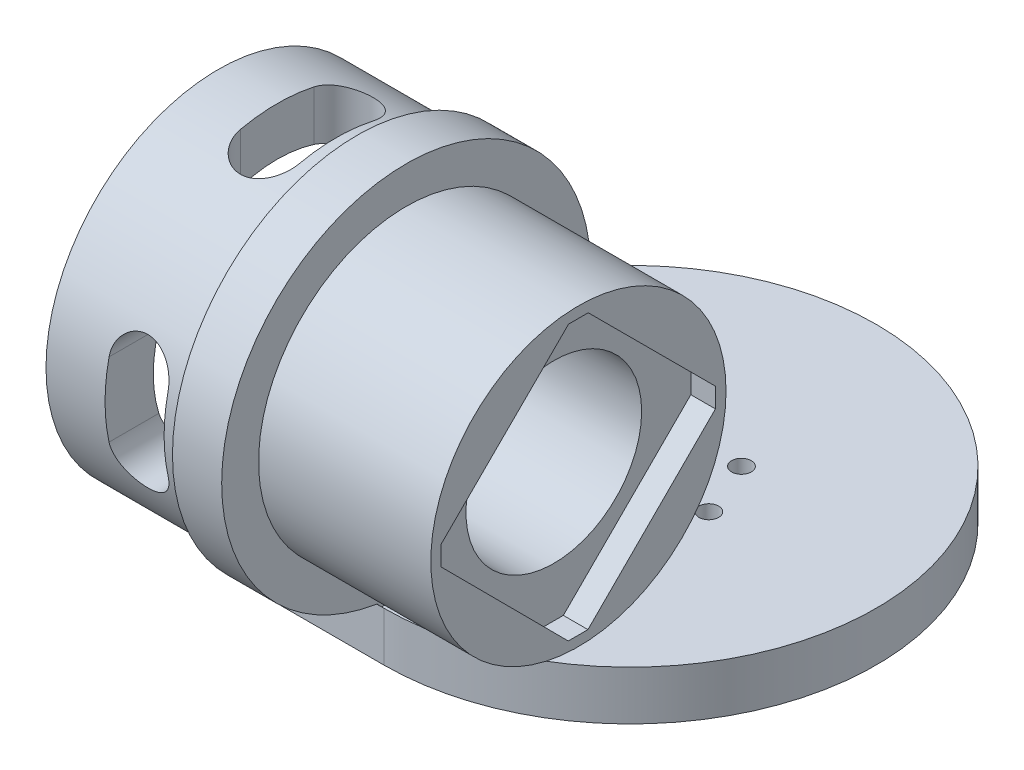
from build123d import *
from build123d.topology import SkipClean

# Parameters (mm, degrees)
SKETCH_1_R               = 50
EXTRUDE_1_DEPTH          = 10
SKETCH_2_R               = 1.9999999999999927
CUT_EXTRUDE_1_DEPTH      = 72.4142842854285
PATTERN_CIRCULAR_1_COUNT = 8
SKETCH_6_R               = 30
EXTRUDE_4_DEPTH          = 10
EXTRUDE_START            = -10
EXTRUDE_5_DEPTH          = 10
SKETCH_8_R               = 35
EXTRUDE_6_DEPTH          = 10
SKETCH_9_R               = 25.200000000000003
CUT_EXTRUDE_2_DEPTH      = 10
SKETCH_10_R              = 35
SKETCH_10_R_2            = 25.20000000000001
EXTRUDE_7_DEPTH          = 7.5
SKETCH_11_R              = 35
SKETCH_11_R_2            = 1.2500000000000047
SKETCH_11_R_3            = 1.2500000000000013
SKETCH_11_R_4            = 12.000000000000005
EXTRUDE_8_DEPTH          = 7
SKETCH_12_R              = 30
SKETCH_12_R_2            = 17.85
EXTRUDE_9_DEPTH          = 35
EXTRUDE_START_2          = 7
SKETCH_16_R              = 34.099999999999994
SKETCH_16_R_2            = 32.59999999999999
EXTRUDE_12_DEPTH         = 7
EXTRUDE_START_3          = 1.7
SKETCH_17_R              = 35
SKETCH_17_R_2            = 34.099999999999994
EXTRUDE_13_DEPTH         = 1.7
CUT_EXTRUDE_3_DEPTH      = 39.00000000000001
PATTERN_CIRCULAR_2_COUNT = 2
PATTERN_CIRCULAR_2_ANGLE = 90.0000000000002
EXTRUDE_14_DEPTH         = 5
EXTRUDE_14_DEPTH_BACK    = 5
SKETCH_19_R              = 37.50000000000001
SKETCH_19_R_2            = 30
EXTRUDE_15_REACH         = 139.9
SKETCH_22_R              = 30
EXTRUDE_16_DEPTH         = 5
EXTRUDE_17_DEPTH         = 5


with BuildPart() as part:
    # 草图1 → 凸台-拉伸1 (new body)
    with BuildSketch(Plane(origin=(0, 0, 0), x_dir=(1, 0, 0), z_dir=(0, 1, 0))):
        with Locations(Location((0, 0, 0), (0, 0, 270))):
            Circle(SKETCH_1_R)
    extrude(amount=EXTRUDE_1_DEPTH)

    # 草图2 → 切除-拉伸1 (cut, through all)
    with BuildSketch(Plane(origin=(0, 10, 0), x_dir=(1, 0, 0), z_dir=(0, 1, 0))):
        with Locations(Location((0, -15.999999999999996, 0), (0, 0, 270))):
            Circle(SKETCH_2_R)
    cut_extrude_1 = extrude(amount=-CUT_EXTRUDE_1_DEPTH, mode=Mode.SUBTRACT)

    # 阵列(圆周)1: 切除-拉伸1 ×8 about axis
    pattern_circular_1_axis = Axis((1.404e-14, 0, 3e-17), (0, 1, 0))
    for i in range(1, PATTERN_CIRCULAR_1_COUNT):
        add(cut_extrude_1.rotate(pattern_circular_1_axis, i * 360 / PATTERN_CIRCULAR_1_COUNT), mode=Mode.SUBTRACT)

    # 草图6 → 凸台-拉伸4 (add)
    with BuildSketch(Plane(origin=(-20, 0, 0), x_dir=(0, 0, -1), z_dir=(1, 0, 0))):
        with Locations((-45.00000000000001, 48)):
            Circle(SKETCH_6_R)
        with BuildLine():
            Line((-66.57470511060487, 27.1545664619217), (-50, 10))
            Line((-50, 10), (20, 10))
            Line((20, 10), (-20.793603948134574, 65.72146693082246))
            ThreePointArc((-20.793603948134578, 65.72146693082246), (-16.48516279587097, 57.322234668898794), (-15.000000000000007, 48))
            ThreePointArc((-15.000000000000007, 47.99999999999999), (-33.75813968504649, 20.185964394588957), (-66.57470511060488, 27.154566461921696))
        make_face()
    extrude(amount=-EXTRUDE_4_DEPTH)

    # 草图7 → 凸台-拉伸5 (add)
    with BuildSketch(Plane.XZ.offset(EXTRUDE_START)):
        with BuildLine():
            Line((-20, 50.000000000000014), (-30, 50.000000000000014))
            Line((-30, 50.000000000000014), (-44.11764705882355, 23.52941176470589))
            ThreePointArc((-44.11764705882352, 23.529411764705895), (-25.724787771376317, 42.874646285627215), (3.06e-15, 50))
            Line((0, 50), (-20, 50.000000000000014))
        make_face()
    extrude(amount=EXTRUDE_5_DEPTH)

    # 草图8 → 凸台-拉伸6 (add)
    with BuildSketch(Plane.ZY.offset(30)):
        with Locations((45.00000000000001, 48)):
            Circle(SKETCH_8_R)
    extrude(amount=-EXTRUDE_6_DEPTH)

    # 草图9 → 切除-拉伸2 (cut)
    with BuildSketch(Plane.ZY.offset(30)):
        with Locations((45.00000000000001, 48)):
            Circle(SKETCH_9_R)
    extrude(amount=-CUT_EXTRUDE_2_DEPTH, mode=Mode.SUBTRACT)

    # 草图10 → 凸台-拉伸7 (add)
    with SkipClean():  # the faces are left unmerged after this step: merging them gives an invalid solid
        with BuildSketch(Plane(origin=(-20, 0, 0), x_dir=(0, 0, -1), z_dir=(1, 0, 0))):
            with Locations(Location((-45.00000000000001, 48, 0), (0, 0, 255.017807985))):
                Circle(SKETCH_10_R)
            with Locations(Location((-45.00000000000001, 48, 0), (0, 0, 180))):
                Circle(SKETCH_10_R_2, mode=Mode.SUBTRACT)
        extrude(amount=EXTRUDE_7_DEPTH)

    # 草图11 → 凸台-拉伸8 (add)
    with SkipClean():  # the faces are left unmerged after this step: merging them gives an invalid solid
        with BuildSketch(Plane(origin=(-12.5, 0, 0), x_dir=(0, 0, -1), z_dir=(1, 0, 0))):
            with Locations(Location((-45.00000000000001, 48, 0), (0, 0, 255.017807985))):
                Circle(SKETCH_11_R)
            with Locations((-45.00000000000001, 63)):
                Circle(SKETCH_11_R_2, mode=Mode.SUBTRACT)
            with Locations((-30.000000000000007, 48)):
                Circle(SKETCH_11_R_3, mode=Mode.SUBTRACT)
            with Locations((-60.00000000000001, 48)):
                Circle(SKETCH_11_R_2, mode=Mode.SUBTRACT)
            with Locations((-45.00000000000001, 33)):
                Circle(SKETCH_11_R_2, mode=Mode.SUBTRACT)
            with Locations((-45.00000000000001, 48)):
                Circle(SKETCH_11_R_4, mode=Mode.SUBTRACT)
        extrude(amount=EXTRUDE_8_DEPTH)

    # 草图12 → 凸台-拉伸9 (add)
    with SkipClean():  # the faces are left unmerged after this step: merging them gives an invalid solid
        with BuildSketch(Plane(origin=(-5.500000000000001, 0, 0), x_dir=(0, 0, -1), z_dir=(1, 0, 0))):
            with Locations((-45.00000000000001, 48)):
                Circle(SKETCH_12_R)
            with Locations((-45.00000000000001, 48)):
                Circle(SKETCH_12_R_2, mode=Mode.SUBTRACT)
        extrude(amount=EXTRUDE_9_DEPTH)

    # 草图16 → 凸台-拉伸12 (add)
    # profile 1 of 2: a face of its own
    with SkipClean():  # the faces are left unmerged after this step: merging them gives an invalid solid
        with BuildSketch(Plane.ZY.offset(30).offset(EXTRUDE_START_2)):
            with BuildLine():
                ThreePointArc((54.04815853046854, 14.18978220703822), (72.7640554365388, 26.689035082455778), (80, 47.99999999999999))
                ThreePointArc((80, 48), (46.58925584695761, 82.96389946577628), (10.144327665547948, 51.17523323762416))
                ThreePointArc((10.144327665547948, 51.17523323762416), (22.4503250761864, 21.2322552158324), (54.04815853046854, 14.18978220703822))
            make_face()
            with Locations((45.00000000000001, 48)):
                Circle(SKETCH_16_R, mode=Mode.SUBTRACT)
        # profile 2 of 2: a face of its own
        with BuildSketch(Plane.ZY.offset(30).offset(EXTRUDE_START_2)):
            with Locations((45.00000000000001, 48)):
                Circle(SKETCH_16_R)
            with Locations((45.00000000000001, 48)):
                Circle(SKETCH_16_R_2, mode=Mode.SUBTRACT)
        extrude(amount=-EXTRUDE_12_DEPTH)

    # 草图17 → 凸台-拉伸13 (add)
    with SkipClean():  # the faces are left unmerged after this step: merging them gives an invalid solid
        with BuildSketch(Plane.ZY.offset(37).offset(EXTRUDE_START_3)):
            with Locations((45.00000000000001, 48)):
                Circle(SKETCH_17_R)
            with Locations((45.00000000000001, 48)):
                Circle(SKETCH_17_R_2, mode=Mode.SUBTRACT)
        extrude(amount=-EXTRUDE_13_DEPTH)

    # 草图18 → 切除-拉伸3 (cut)
    with SkipClean():  # the faces are left unmerged after this step: merging them gives an invalid solid
        with BuildSketch(Plane.XY.offset(50)):
            with BuildLine():
                Line((-14.700000000000037, 55.50000000000001), (-14.700000000000031, 40.5))
                ThreePointArc((-14.700000000000031, 40.5), (-20.70000000000003, 34.5), (-26.700000000000035, 40.5))
                Line((-26.700000000000035, 40.5), (-26.70000000000004, 55.49999999999999))
                ThreePointArc((-26.70000000000004, 55.49999999999999), (-20.70000000000004, 61.5), (-14.700000000000037, 55.50000000000001))
            make_face()
        cut_extrude_3 = extrude(amount=CUT_EXTRUDE_3_DEPTH, mode=Mode.SUBTRACT)

    # 阵列(圆周)2: 切除-拉伸3 ×2 about axis
    with SkipClean():  # the faces are left unmerged after this step: merging them gives an invalid solid
        pattern_circular_2_axis = Axis((78.99494936611666, 48, 45.00000000000001), (-1, 0, 0))
        for i in range(1, PATTERN_CIRCULAR_2_COUNT):
            add(cut_extrude_3.rotate(pattern_circular_2_axis, i * PATTERN_CIRCULAR_2_ANGLE / (PATTERN_CIRCULAR_2_COUNT - 1)), mode=Mode.SUBTRACT)

    # 草图19 → 凸台-拉伸14 (add, two sides: drawn at the far end of the back side and taken through both)
    with SkipClean():  # the faces are left unmerged after this step: merging them gives an invalid solid
        with BuildSketch(Plane(origin=(-5.500000000000001, 0, 0), x_dir=(0, 0, -1), z_dir=(1, 0, 0)).offset(-EXTRUDE_14_DEPTH_BACK)):
            with Locations((-45.00000000000001, 48)):
                Circle(SKETCH_19_R)
            with Locations((-45.00000000000001, 48)):
                Circle(SKETCH_19_R_2, mode=Mode.SUBTRACT)
        extrude(amount=EXTRUDE_14_DEPTH + EXTRUDE_14_DEPTH_BACK)

    # 凸台-拉伸15: up to this face of the body (flat: up to its plane)
    extrude_15_end = Plane(part.part.faces().sort_by_distance((-0.5, 48, 81.439339828))[0])
    # 草图21 → 凸台-拉伸15 (add, up to the picked face)
    with BuildSketch(Plane(origin=(-20, 0, 0), x_dir=(0, 0, -1), z_dir=(1, 0, 0)), mode=Mode.PRIVATE) as extrude_15_sk1:
        with BuildLine():
            Line((-54.048158530468555, 14.189782207038219), (-50, 10.000000000000002))
            Line((-50, 10.000000000000002), (-25, 10))
            Line((-25, 10), (-20.789070824021746, 22.72489548120987))
            ThreePointArc((-20.78907082402175, 22.72489548120988), (-36.300032007942924, 14.098516891776221), (-54.048158530468555, 14.18978220703822))
        make_face()
    extrude_15_tool1 = split(extrude(extrude_15_sk1.sketch, amount=EXTRUDE_15_REACH, mode=Mode.PRIVATE), bisect_by=extrude_15_end, keep=Keep.BOTH, mode=Mode.PRIVATE)
    add(extrude_15_tool1.solids().sort_by(Axis((-20, 13.28361, 34.159805), (1, 0, 0)))[0])

    # 草图22 → 凸台-拉伸16 (add)
    with BuildSketch(Plane(origin=(29.500000000000004, 0, 0), x_dir=(0, 0, -1), z_dir=(1, 0, 0))):
        with Locations((-45.00000000000001, 48)):
            Circle(SKETCH_22_R)
        Polygon((-74.91061684419095, 47.99999999999995), (-45.00025054949128, 77.76927926767611), (-15.160260801057072, 47.92945668419983), (-45.07089861755983, 18.036484102537916), align=None, mode=Mode.SUBTRACT)
    extrude(amount=EXTRUDE_16_DEPTH)

    # 草图23 → 凸台-拉伸17 (add)
    with BuildSketch(Plane(origin=(29.500000000000004, 0, 0), x_dir=(0, 0, -1), z_dir=(1, 0, 0))):
        Polygon((-45.00025054949128, 77.76927926767611), (-47.004973093070014, 75.77401298888844), (-43.004973093070014, 75.77401298888844), align=None)
        Polygon((-72.91004844309327, 45.99113173137293), (-72.91004844309327, 49.99113173137294), (-74.91061684419095, 47.99999999999995), align=None)
        Polygon((-15.160260801057074, 47.92945668419983), (-17.160857181289597, 49.9300418570019), (-17.160857181289597, 45.930041857001896), align=None)
        Polygon((-43.06616767917176, 20.040031046019667), (-47.06616767917177, 20.040031046019667), (-45.07089861755983, 18.036484102537912), align=None)
    extrude(amount=EXTRUDE_17_DEPTH)


solid = part.part
